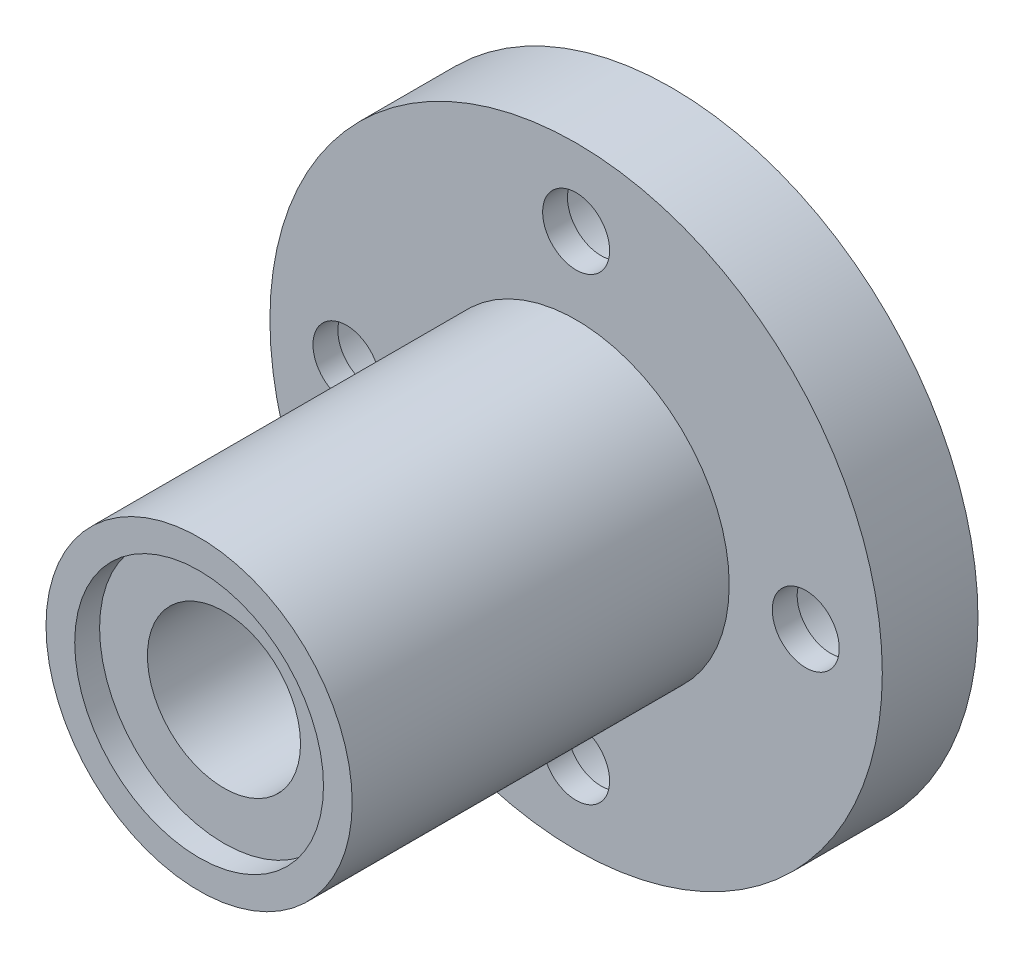
from build123d import *

# Parameters (mm, degrees)
IZIM1_R                     = 16
Y_KSEKLIK_EKSTR_ZYON1_DEPTH = 5
IZIM2_R                     = 8
Y_KSEKLIK_EKSTR_ZYON2_DEPTH = 19.7
KES_EKSTR_ZYON1_REACH       = 35.498
IZIM3_R                     = 4
KES_EKSTR_ZYON2_REACH       = 35.498
IZIM4_R                     = 1.75
IZIM4_3_R                   = 3.25
IZIM4_3_R_2                 = 1.75
KES_EKSTR_ZYON3_DEPTH       = 3.7
IZIM5_R                     = 6.5
KES_EKSTR_ZYON4_DEPTH       = 1.3
KES_EKSTR_ZYON5_START       = -23.4
IZIM5_2_R                   = 6.5
KES_EKSTR_ZYON5_DEPTH       = 1.3


with BuildPart() as part:
    # Çizim1 → Yükseklik-Ekstrüzyon1 (new body)
    with BuildSketch(Plane.XY):
        Circle(IZIM1_R)
    extrude(amount=Y_KSEKLIK_EKSTR_ZYON1_DEPTH)

    # Çizim2 → Yükseklik-Ekstrüzyon2 (add)
    with BuildSketch(Plane.XY.offset(5)):
        Circle(IZIM2_R)
    extrude(amount=Y_KSEKLIK_EKSTR_ZYON2_DEPTH)

    # Çizim3 → Kes-Ekstrüzyon1 (cut, up to next)
    with BuildSketch(Plane.XY.offset(24.7), mode=Mode.PRIVATE) as kes_ekstr_zyon1_sk1:
        Circle(IZIM3_R)
    kes_ekstr_zyon1_tool1 = extrude(kes_ekstr_zyon1_sk1.sketch, amount=-KES_EKSTR_ZYON1_REACH, mode=Mode.PRIVATE) & part.part
    add(kes_ekstr_zyon1_tool1.solids().sort_by_distance((0, 0, 24.7))[0], mode=Mode.SUBTRACT)

    # Çizim4 → Kes-Ekstrüzyon2 (cut, up to next)
    with BuildSketch(Plane(origin=(0, 0, 0), x_dir=(-1, 0, 0), z_dir=(0, 0, -1)), mode=Mode.PRIVATE) as kes_ekstr_zyon2_sk1:
        with Locations((0, 12)):
            Circle(IZIM4_R)
    kes_ekstr_zyon2_tool1 = extrude(kes_ekstr_zyon2_sk1.sketch, amount=-KES_EKSTR_ZYON2_REACH, mode=Mode.PRIVATE) & part.part
    # Çizim4 → Kes-Ekstrüzyon2 (cut, up to next)
    with BuildSketch(Plane(origin=(0, 0, 0), x_dir=(-1, 0, 0), z_dir=(0, 0, -1)), mode=Mode.PRIVATE) as kes_ekstr_zyon2_sk2:
        with Locations((12, 0)):
            Circle(IZIM4_R)
    kes_ekstr_zyon2_tool2 = extrude(kes_ekstr_zyon2_sk2.sketch, amount=-KES_EKSTR_ZYON2_REACH, mode=Mode.PRIVATE) & part.part
    # Çizim4 → Kes-Ekstrüzyon2 (cut, up to next)
    with BuildSketch(Plane(origin=(0, 0, 0), x_dir=(-1, 0, 0), z_dir=(0, 0, -1)), mode=Mode.PRIVATE) as kes_ekstr_zyon2_sk3:
        with Locations((0, -12)):
            Circle(IZIM4_R)
    kes_ekstr_zyon2_tool3 = extrude(kes_ekstr_zyon2_sk3.sketch, amount=-KES_EKSTR_ZYON2_REACH, mode=Mode.PRIVATE) & part.part
    # Çizim4 → Kes-Ekstrüzyon2 (cut, up to next)
    with BuildSketch(Plane(origin=(0, 0, 0), x_dir=(-1, 0, 0), z_dir=(0, 0, -1)), mode=Mode.PRIVATE) as kes_ekstr_zyon2_sk4:
        with Locations((-12, 0)):
            Circle(IZIM4_R)
    kes_ekstr_zyon2_tool4 = extrude(kes_ekstr_zyon2_sk4.sketch, amount=-KES_EKSTR_ZYON2_REACH, mode=Mode.PRIVATE) & part.part
    add(kes_ekstr_zyon2_tool1.solids().sort_by_distance((0, 12, 0))[0], mode=Mode.SUBTRACT)
    add(kes_ekstr_zyon2_tool2.solids().sort_by_distance((-12, 0, 0))[0], mode=Mode.SUBTRACT)
    add(kes_ekstr_zyon2_tool3.solids().sort_by_distance((0, -12, 0))[0], mode=Mode.SUBTRACT)
    add(kes_ekstr_zyon2_tool4.solids().sort_by_distance((12, 0, 0))[0], mode=Mode.SUBTRACT)

    # Çizim4<3> → Kes-Ekstrüzyon3 (cut)
    # profile 1 of 4: a face of its own
    with BuildSketch(Plane(origin=(0, 0, 0), x_dir=(-1, 0, 0), z_dir=(0, 0, -1))):
        with Locations((0, 12)):
            Circle(IZIM4_3_R)
        with Locations((0, 12)):
            Circle(IZIM4_3_R_2, mode=Mode.SUBTRACT)
    # profile 2 of 4: a face of its own
    with BuildSketch(Plane(origin=(0, 0, 0), x_dir=(-1, 0, 0), z_dir=(0, 0, -1))):
        with Locations((12, 0)):
            Circle(IZIM4_3_R)
        with Locations((12, 0)):
            Circle(IZIM4_3_R_2, mode=Mode.SUBTRACT)
    # profile 3 of 4: a face of its own
    with BuildSketch(Plane(origin=(0, 0, 0), x_dir=(-1, 0, 0), z_dir=(0, 0, -1))):
        with Locations((0, -12)):
            Circle(IZIM4_3_R)
        with Locations((0, -12)):
            Circle(IZIM4_3_R_2, mode=Mode.SUBTRACT)
    # profile 4 of 4: a face of its own
    with BuildSketch(Plane(origin=(0, 0, 0), x_dir=(-1, 0, 0), z_dir=(0, 0, -1))):
        with Locations((-12, 0)):
            Circle(IZIM4_3_R)
        with Locations((-12, 0)):
            Circle(IZIM4_3_R_2, mode=Mode.SUBTRACT)
    extrude(amount=-KES_EKSTR_ZYON3_DEPTH, mode=Mode.SUBTRACT)

    # Çizim5 → Kes-Ekstrüzyon4 (cut)
    with BuildSketch(Plane.XY.offset(24.7)):
        Circle(IZIM5_R)
    extrude(amount=-KES_EKSTR_ZYON4_DEPTH, mode=Mode.SUBTRACT)

    # Çizim5<2> → Kes-Ekstrüzyon5 (cut)
    with BuildSketch(Plane.XY.offset(24.7).offset(KES_EKSTR_ZYON5_START)):
        Circle(IZIM5_2_R)
    extrude(amount=-KES_EKSTR_ZYON5_DEPTH, mode=Mode.SUBTRACT)


solid = part.part
